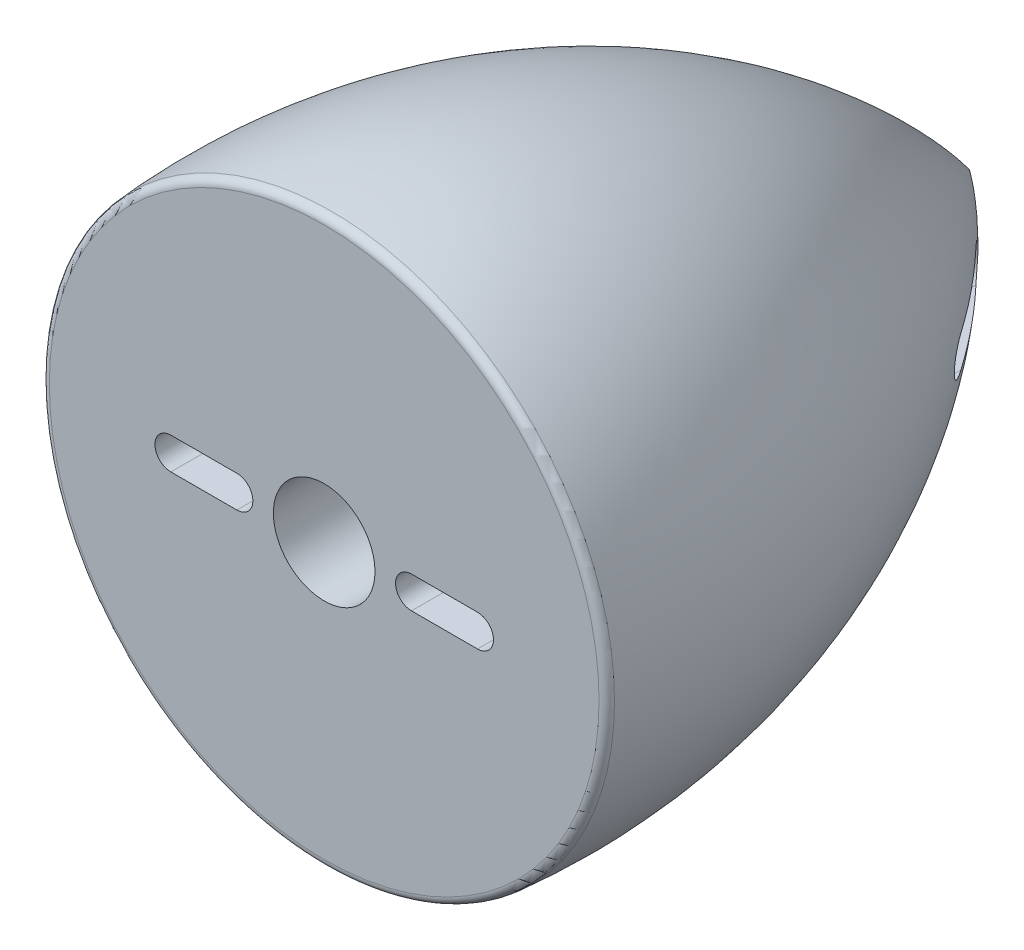
from build123d import *

# Parameters (mm, degrees)
FILLET4_R          = 0.635
SKETCH10_R         = 4.0005
CUT_EXTRUDE5_DEPTH = 11.684
CUT_EXTRUDE6_DEPTH = 82.55


with BuildPart() as part:
    # Sketch9 → Revolve2 (revolve)
    with BuildSketch(Plane(origin=(0, 0, 0), x_dir=(0, 0, -1), z_dir=(1, 0, 0))):
        with BuildLine():
            Line((0, 0), (50.8, 0))
            ThreePointArc((50.8, 0), (28.251626652, 17.630503777), (0, 22.225))
            Line((0, 22.225), (0, 0))
        make_face()
    revolve(axis=Axis((0, 0, 0), (0, 0, -1)))

    # Fillet4
    fillet4_edges = [part.edges().sort_by_distance(p)[0] for p in [
        (0, -22.225, 0),
    ]]
    fillet(fillet4_edges, radius=FILLET4_R)

    # Sketch10 → Cut-Extrude5 (cut)
    with BuildSketch(Plane.XY):
        Circle(SKETCH10_R)
    extrude(amount=-CUT_EXTRUDE5_DEPTH, mode=Mode.SUBTRACT)

    # Sketch11 → Cut-Extrude6 (cut)
    with BuildSketch(Plane.XY):
        with BuildLine():
            Line((6.872643409, 1.269271981), (12.073562746, 1.269271981))
            ThreePointArc((12.073562746, 1.269271981), (13.327653654, 0.015181073), (12.073562746, -1.238909835))
            Line((12.073562746, -1.238909835), (6.872643409, -1.238909835))
            ThreePointArc((6.872643409, -1.238909835), (5.618552501, 0.015181073), (6.872643409, 1.269271981))
        make_face()
        with BuildLine():
            Line((-6.872643409, 1.269271981), (-12.073562746, 1.269271981))
            ThreePointArc((-12.073562746, 1.269271981), (-13.327653654, 0.015181073), (-12.073562746, -1.238909835))
            Line((-12.073562746, -1.238909835), (-6.872643409, -1.238909835))
            ThreePointArc((-6.872643409, -1.238909835), (-5.618552501, 0.015181073), (-6.872643409, 1.269271981))
        make_face()
    extrude(amount=-CUT_EXTRUDE6_DEPTH, mode=Mode.SUBTRACT)


solid = part.part
